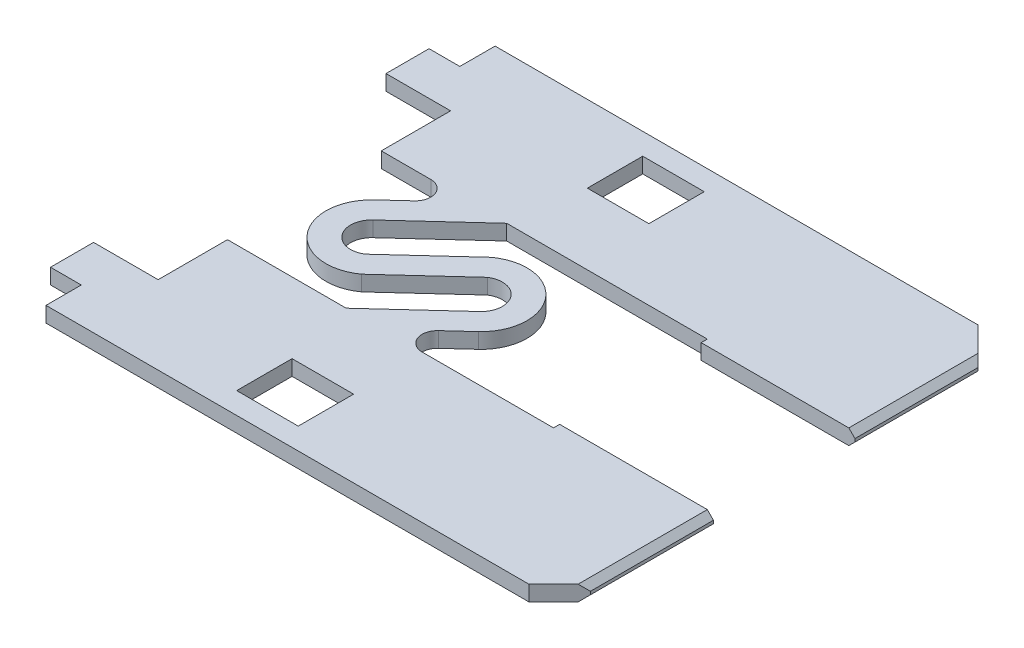
from build123d import *

# Parameters (mm, degrees)
SKETCH1_W           = 2
SKETCH1_H           = 1.8
BOSS_EXTRUDE1_DEPTH = 0.5
CHAMFER1_SIZE       = 0.2


with BuildPart() as part:
    # Sketch1 → Boss-Extrude1 (new body)
    with BuildSketch(Plane(origin=(0, 0, 0), x_dir=(1, 0, 0), z_dir=(0, 1, 0))):
        with BuildLine():
            Line((-6.744590168, 7.3), (8.955409832, 7.3))
            Line((8.955409832, 7.3), (9.955409832, 6.3))
            Line((9.955409832, 6.3), (9.955409832, 2.3))
            Line((9.955409832, 2.3), (4.955409832, 2.3))
            Line((4.955409832, 2.3), (4.955409832, 2.5))
            Line((4.955409832, 2.5), (-1.565729119, 2.5))
            Line((-1.565729119, 2.5), (-3.83310718, 0.421156991))
            ThreePointArc((-3.83310718, 0.421156991), (-3.912248176, -0.508574312), (-2.992299199, -0.664643125))
            Line((-2.992299199, -0.664643125), (-2.267378061, 0))
            Line((-2.267378061, 0), (-0.859569395, 1.290747782))
            ThreePointArc((-0.859569395, 1.290747782), (1.169124512, 1.029390936), (1.022775524, -1.010826784))
            Line((1.022775524, -1.010826784), (0.345859604, -1.63145638))
            ThreePointArc((0.345859604, -1.63145638), (0.216903786, -2.179100893), (0.679037836, -2.5))
            Line((0.679037836, -2.5), (4.955409832, -2.5))
            Line((4.955409832, -2.5), (4.955409832, -2.3))
            Line((4.955409832, -2.3), (9.955409832, -2.3))
            Line((9.955409832, -2.3), (9.955409832, -6.3))
            Line((9.955409832, -6.3), (8.955409832, -7.3))
            Line((8.955409832, -7.3), (-6.744590168, -7.3))
            Line((-6.744590168, -7.3), (-6.744590168, -6.153555701))
            Line((-6.744590168, -6.153555701), (-7.744590168, -6.153555701))
            Line((-7.744590168, -6.153555701), (-7.744590168, -4.753555701))
            Line((-7.744590168, -4.753555701), (-5.644590168, -4.753555701))
            Line((-5.644590168, -4.753555701), (-5.644590168, -2.5))
            Line((-5.644590168, -2.5), (-1.785240618, -2.5))
            Line((-1.785240618, -2.5), (0.482137442, -0.421156991))
            ThreePointArc((0.482137442, -0.421156991), (0.561278438, 0.508574312), (-0.358670538, 0.664643125))
            Line((-0.358670538, 0.664643125), (-1.083591677, 0))
            Line((-1.083591677, 0), (-2.491400342, -1.290747782))
            ThreePointArc((-2.491400342, -1.290747782), (-4.52009425, -1.029390936), (-4.373745262, 1.010826784))
            Line((-4.373745262, 1.010826784), (-3.696829341, 1.63145638))
            ThreePointArc((-3.696829341, 1.63145638), (-3.568749704, 2.181284569), (-4.034728143, 2.5))
            Line((-4.034728143, 2.5), (-5.644590168, 2.5))
            Line((-5.644590168, 2.5), (-5.644590168, 4.753555701))
            Line((-5.644590168, 4.753555701), (-7.744590168, 4.753555701))
            Line((-7.744590168, 4.753555701), (-7.744590168, 6.153555701))
            Line((-7.744590168, 6.153555701), (-6.744590168, 6.153555701))
            Line((-6.744590168, 6.153555701), (-6.744590168, 7.3))
        make_face()
        with Locations((-0.244590168, 5.7)):
            Rectangle(SKETCH1_W, SKETCH1_H, mode=Mode.SUBTRACT)
        with Locations((-0.244590168, -5.7)):
            Rectangle(SKETCH1_W, SKETCH1_H, mode=Mode.SUBTRACT)
    extrude(amount=BOSS_EXTRUDE1_DEPTH)

    # Chamfer1
    chamfer1_edges = [part.edges().sort_by_distance(p)[0] for p in [
        (9.955409832, 0.5, -4.3),
        (9.955409832, 0, -4.3),
        (9.955409832, 0, 4.3),
        (9.955409832, 0.5, 4.3),
    ]]
    chamfer(chamfer1_edges, length=CHAMFER1_SIZE)


solid = part.part
